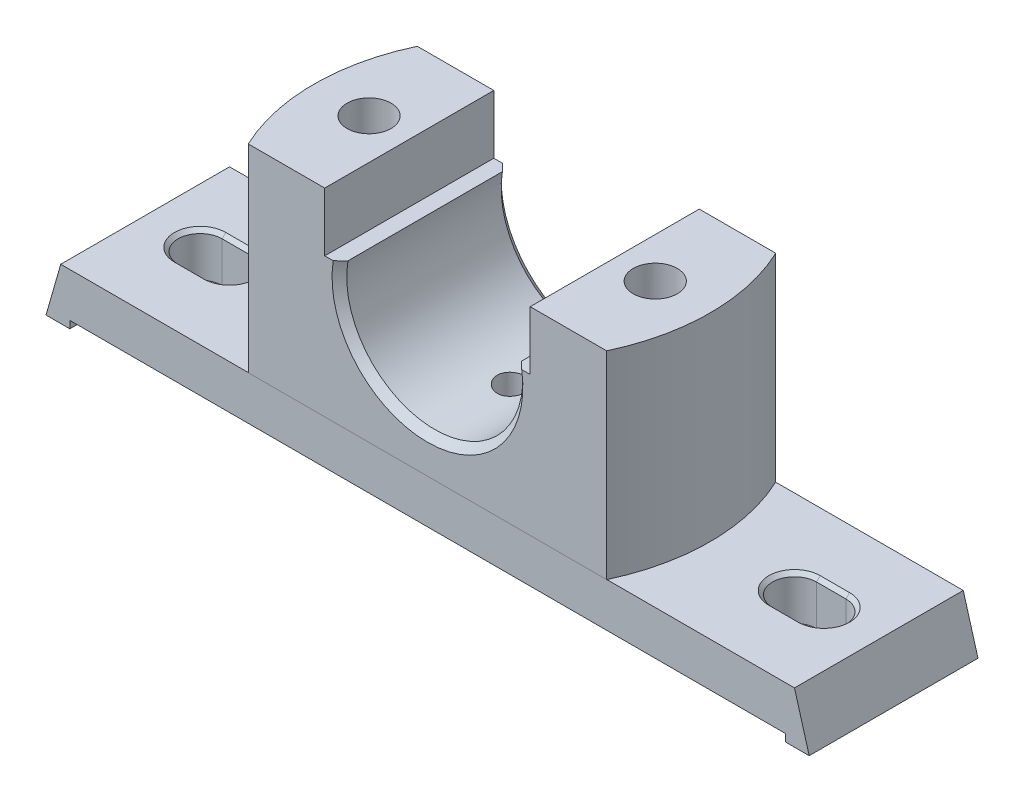
from build123d import *

# Parameters (mm, degrees)
BOSS_EXTRUDE1_DEPTH = 23
BOSS_EXTRUDE2_DEPTH = 54
SKETCH5_R           = 4
CUT_EXTRUDE1_DEPTH  = 52
CUT_EXTRUDE5_DEPTH  = 133.527415876
SKETCH8_R           = 6
CUT_EXTRUDE6_DEPTH  = 127.3759431
CUT_EXTRUDE7_DEPTH  = 120.427295851
SKETCH10_W          = 28
SKETCH10_H          = 28
CUT_EXTRUDE8_DEPTH  = 10
CHAMFER1_SIZE       = 2
CHAMFER2_SIZE       = 1


with BuildPart() as part:
    # Sketch1 → Boss-Extrude1 (new, symmetric)
    with BuildSketch(Plane.XY):
        Polygon((104, 0), (97.5, 0), (97.5, 2), (-97.5, 2), (-97.5, 0), (-104, 0), (-99.985564599, 14), (99.985564599, 14), align=None)
    extrude(amount=BOSS_EXTRUDE1_DEPTH, both=True)

    # Sketch3 → Boss-Extrude2 (add)
    with BuildSketch(Plane(origin=(0, 14, 0), x_dir=(1, 0, 0), z_dir=(0, 1, 0))):
        with BuildLine():
            Line((-48.837700706, 23.040811394), (48.837700706, 23.040811394))
            ThreePointArc((48.837700706, 23.040811394), (54, 0), (48.837700706, -23.040811394))
            Line((48.837700706, -23.040811394), (-48.837700706, -23.040811394))
            ThreePointArc((-48.837700706, -23.040811394), (-54, 0), (-48.837700706, 23.040811394))
        make_face()
    extrude(amount=BOSS_EXTRUDE2_DEPTH)

    # Sketch5 → Cut-Extrude1 (cut)
    with BuildSketch(Plane(origin=(0, 68, 0), x_dir=(1, 0, 0), z_dir=(0, 1, 0))):
        with Locations(Location((0, 0, 0), (0, 0, 180))):
            Circle(SKETCH5_R)
    extrude(amount=-CUT_EXTRUDE1_DEPTH, mode=Mode.SUBTRACT)

    # Sketch6 → Cut-Extrude5 (cut, through all)
    with BuildSketch(Plane.XY.offset(23.040811394)):
        with BuildLine():
            Line((-28, 374.971379092), (-28, 68))
            Line((-28, 68), (-28, 52))
            Line((-28, 52), (-23.664319132, 52))
            ThreePointArc((-23.664319132, 52), (0, 24), (23.664319132, 52))
            Line((23.664319132, 52), (28, 52))
            Line((28, 52), (28, 68))
            Line((28, 68), (28, 374.971379092))
            Line((28, 374.971379092), (28, 988.914137277))
            Line((28, 988.914137277), (-28, 988.914137277))
            Line((-28, 988.914137277), (-28, 374.971379092))
        make_face()
    extrude(amount=-CUT_EXTRUDE5_DEPTH, mode=Mode.SUBTRACT)

    # Sketch8 → Cut-Extrude6 (cut, through all)
    with BuildSketch(Plane(origin=(0, 68, 0), x_dir=(1, 0, 0), z_dir=(0, 1, 0))):
        with Locations(Location((-39, 0.040811394, 0), (0, 0, 180))):
            Circle(SKETCH8_R)
        with Locations(Location((39, 0.040811394, 0), (0, 0, 180))):
            Circle(SKETCH8_R)
    extrude(amount=-CUT_EXTRUDE6_DEPTH, mode=Mode.SUBTRACT)

    # Sketch9 → Cut-Extrude7 (cut, through all)
    with BuildSketch(Plane(origin=(0, 14, 0), x_dir=(1, 0, 0), z_dir=(0, 1, 0))):
        with BuildLine():
            Line((-85, 6), (-77, 6))
            ThreePointArc((-77, 6), (-71, 0), (-77, -6))
            Line((-77, -6), (-85, -6))
            ThreePointArc((-85, -6), (-91, 0), (-85, 6))
        make_face()
        with BuildLine():
            Line((85, 6), (77, 6))
            ThreePointArc((77, 6), (71, 0), (77, -6))
            Line((77, -6), (85, -6))
            ThreePointArc((85, -6), (91, 0), (85, 6))
        make_face()
    extrude(amount=-CUT_EXTRUDE7_DEPTH, mode=Mode.SUBTRACT)

    # Sketch10 → Cut-Extrude8 (cut)
    with BuildSketch(Plane(origin=(0, 2, 0), x_dir=(-1, 0, 0), z_dir=(0, -1, 0))):
        with Locations((39, 0.040811394)):
            Rectangle(SKETCH10_W, SKETCH10_H)
        with Locations((-39, 0.040811394)):
            Rectangle(SKETCH10_W, SKETCH10_H)
    extrude(amount=-CUT_EXTRUDE8_DEPTH, mode=Mode.SUBTRACT)

    # Chamfer1
    chamfer1_edges = [part.edges().sort_by_distance(p)[0] for p in [
        (0, 24, -23.040811394),
        (0, 24, 23.040811394),
    ]]
    chamfer(chamfer1_edges, length=CHAMFER1_SIZE)

    # Chamfer2
    chamfer2_edges = [part.edges().sort_by_distance(p)[0] for p in [
        (91, 14, 0),
        (81, 14, -6),
        (71, 14, 0),
        (81, 14, 6),
        (-91, 14, 0),
        (-81, 14, 6),
        (-71, 14, 0),
        (-81, 14, -6),
    ]]
    chamfer(chamfer2_edges, length=CHAMFER2_SIZE)


solid = part.part
